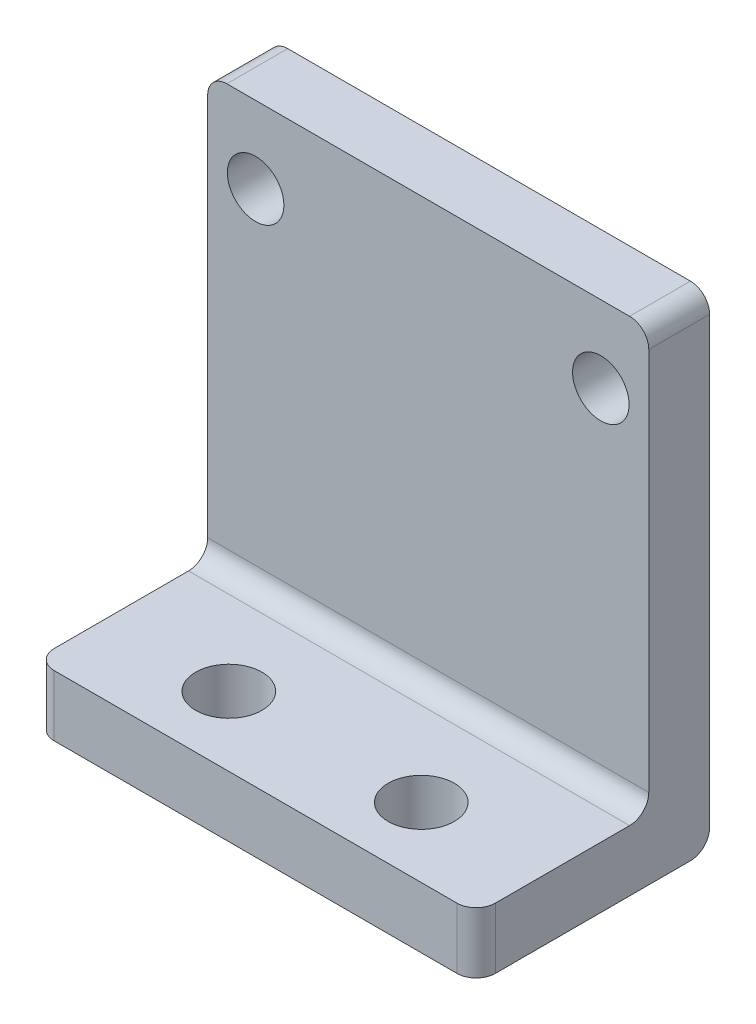
from build123d import *

# Parameters (mm, degrees)
SKETCH1_W             = 23
SKETCH1_H             = 20
SKETCH1_R             = 1.4732
SKETCH1_H_2           = 3.175
SKETCH1_H_3           = 2
BOSS_EXTRUDE1_DEPTH   = 3.175
BOSS_EXTRUDE2_START   = 3.175
SKETCH1_3_W           = 23
SKETCH1_3_H           = 3.175
BOSS_EXTRUDE2_DEPTH   = 9
F_8_32_TAPPED_HOLE1_D = 3.4544
FILLET1_R             = 1


with BuildPart() as part:
    # Sketch1 → Boss-Extrude1 (new body)
    # profile 1 of 3: a face of its own
    with BuildSketch(Plane.XY):
        with Locations((11.5, -10)):
            Rectangle(SKETCH1_W, SKETCH1_H)
        with Locations((2.5, -2)):
            Circle(SKETCH1_R, mode=Mode.SUBTRACT)
        with Locations((20.5, -2)):
            Circle(SKETCH1_R, mode=Mode.SUBTRACT)
    # profile 2 of 3: a face of its own
    with BuildSketch(Plane.XY):
        with Locations((11.5, -21.5875)):
            Rectangle(SKETCH1_W, SKETCH1_H_2)
    # profile 3 of 3: a face of its own
    with BuildSketch(Plane.XY):
        with Locations((11.5, 1)):
            Rectangle(SKETCH1_W, SKETCH1_H_3)
    extrude(amount=BOSS_EXTRUDE1_DEPTH)

    # Sketch1<3> → Boss-Extrude2 (add)
    with BuildSketch(Plane.XY.offset(BOSS_EXTRUDE2_START)):
        with Locations((11.5, -21.5875)):
            Rectangle(SKETCH1_3_W, SKETCH1_3_H)
    extrude(amount=BOSS_EXTRUDE2_DEPTH)

    # #8-32 Tapped Hole1 (through all)
    with Locations(Plane(origin=(6.4835, -20, 8.5555), x_dir=(1, 0, 0), z_dir=(0, 1, 0))):
        with Locations((0, 0), (10.033, 0)):
            Hole(F_8_32_TAPPED_HOLE1_D / 2)

    # Fillet1
    fillet1_edges = [part.edges().sort_by_distance(p)[0] for p in [
        (0, 2, 1.5875),
        (23, 2, 1.5875),
        (0, -21.5875, 12.175),
        (11.5, -20, 3.175),
        (23, -21.5875, 12.175),
        (11.5, -23.175, 0),
    ]]
    fillet(fillet1_edges, radius=FILLET1_R)


solid = part.part
